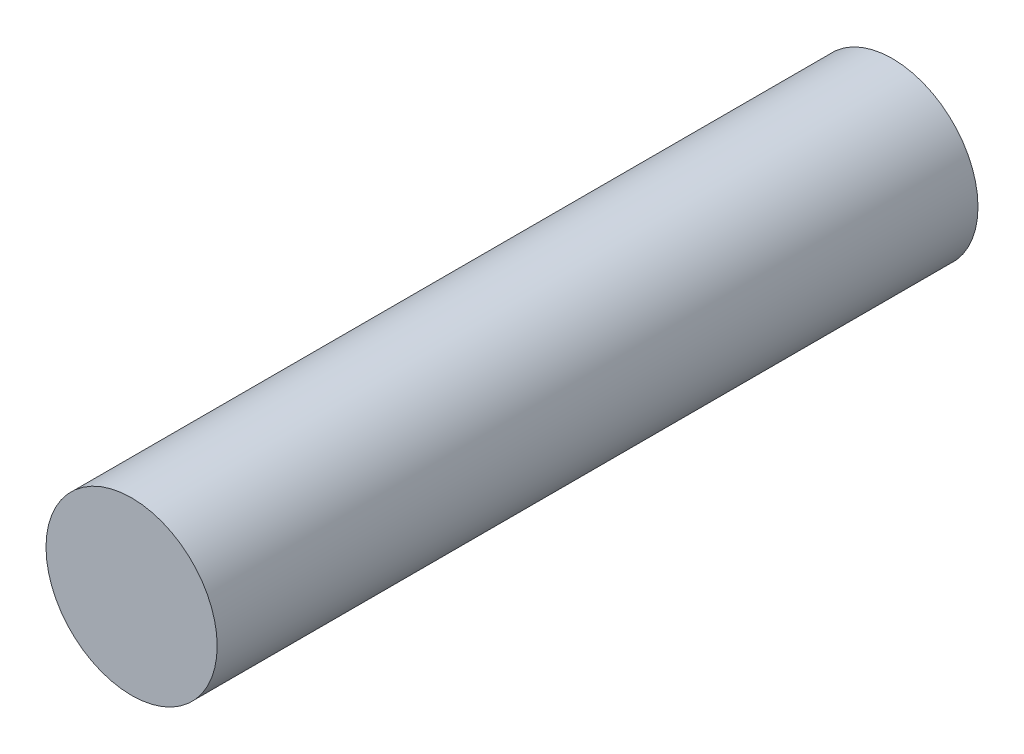
from build123d import *

# Parameters (mm, degrees)
SKETCH1_R           = 4.5
BOSS_EXTRUDE1_DEPTH = 40


with BuildPart() as part:
    # Sketch1 → Boss-Extrude1 (new body)
    with BuildSketch(Plane.XY):
        Circle(SKETCH1_R)
    extrude(amount=BOSS_EXTRUDE1_DEPTH)


solid = part.part
